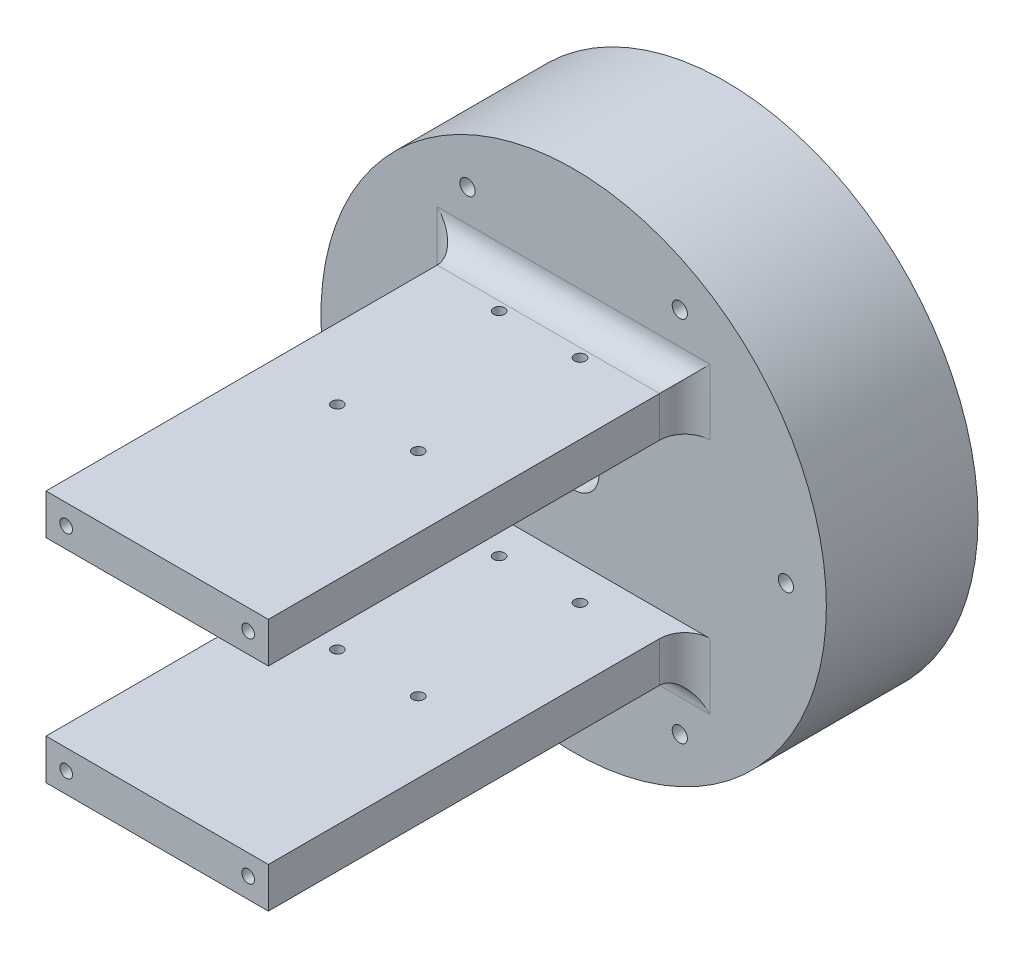
from build123d import *

# Parameters (mm, degrees)
CROQUIS1_R              = 50
SALIENTE_EXTRUIR1_DEPTH = 30
CROQUIS2_R              = 40.25
CORTAR_EXTRUIR1_DEPTH   = 10.5
CROQUIS3_R              = 21.5
SALIENTE_EXTRUIR2_DEPTH = 12.9
CORTAR_EXTRUIR2_DEPTH   = 12.9
CROQUIS7_W              = 44
CROQUIS7_H              = 8
SALIENTE_EXTRUIR3_DEPTH = 82.4
REDONDEO1_R             = 5
CORTAR_EXTRUIR3_REACH   = 146.079
CROQUIS8_R              = 1.1
CROQUIS9_R              = 1.5
CORTAR_EXTRUIR4_DEPTH   = 7
CROQUIS11_R             = 1.25
CORTAR_EXTRUIR5_DEPTH   = 15
SALIENTE_EXTRUIR4_START = 10.5
CROQUIS12_R             = 40.25
CROQUIS12_R_2           = 37.68
SALIENTE_EXTRUIR4_DEPTH = 10.5
CORTAR_EXTRUIR6_REACH   = 126.031
CROQUIS13_R             = 5
CROQUIS14_W             = 27
CROQUIS14_H             = 10
CORTAR_EXTRUIR7_DEPTH   = 5
CORTAR_EXTRUIR8_START   = -2.5
CROQUIS15_R             = 35
CROQUIS15_R_2           = 21.5
CORTAR_EXTRUIR8_DEPTH   = 2.5


with BuildPart() as part:
    # Croquis1 → Saliente-Extruir1 (new body)
    with BuildSketch(Plane.XY):
        Circle(CROQUIS1_R)
    extrude(amount=SALIENTE_EXTRUIR1_DEPTH)

    # Croquis2 → Cortar-Extruir1 (cut)
    with BuildSketch(Plane(origin=(0, 0, 0), x_dir=(-1, 0, 0), z_dir=(0, 0, -1))):
        Circle(CROQUIS2_R)
    extrude(amount=-CORTAR_EXTRUIR1_DEPTH, mode=Mode.SUBTRACT)

    # Croquis3 → Saliente-Extruir2 (add)
    with BuildSketch(Plane(origin=(0, 0, 10.5), x_dir=(-1, 0, 0), z_dir=(0, 0, -1))):
        with Locations(Location((0, 0, 0), (0, 0, 180))):
            Circle(CROQUIS3_R)
    extrude(amount=SALIENTE_EXTRUIR2_DEPTH)

    # Croquis4 → Cortar-Extruir2 (cut)
    with BuildSketch(Plane(origin=(0, 0, -2.4), x_dir=(-1, 0, 0), z_dir=(0, 0, -1))):
        with BuildLine():
            ThreePointArc((-0.668583659, -6.566048727), (0.596468383, -7.752086846), (1.665189454, -6.386481354))
            ThreePointArc((1.665189454, -6.386481354), (2.986052332, -5.885872193), (4.170137542, -5.11565762))
            ThreePointArc((4.170137542, -5.11565762), (5.903320016, -5.059786339), (5.693391028, -3.338457518))
            ThreePointArc((5.693391028, -3.338457518), (6.273397994, -2.050482288), (6.566048727, -0.668583659))
            ThreePointArc((6.566048727, -0.668583659), (7.752086846, 0.596468383), (6.386481354, 1.665189454))
            ThreePointArc((6.386481354, 1.665189454), (5.885872193, 2.986052332), (5.11565762, 4.170137542))
            ThreePointArc((5.11565762, 4.170137542), (5.059786339, 5.903320016), (3.338457518, 5.693391028))
            ThreePointArc((3.338457518, 5.693391028), (2.050482288, 6.273397994), (0.668583659, 6.566048727))
            ThreePointArc((0.668583659, 6.566048727), (-0.596468383, 7.752086846), (-1.665189454, 6.386481354))
            ThreePointArc((-1.665189454, 6.386481354), (-2.986052332, 5.885872193), (-4.170137542, 5.11565762))
            ThreePointArc((-4.170137542, 5.11565762), (-5.903320016, 5.059786339), (-5.693391028, 3.338457518))
            ThreePointArc((-5.693391028, 3.338457518), (-6.273397994, 2.050482288), (-6.566048727, 0.668583659))
            ThreePointArc((-6.566048727, 0.668583659), (-7.752086846, -0.596468383), (-6.386481354, -1.665189454))
            ThreePointArc((-6.386481354, -1.665189454), (-5.885872193, -2.986052332), (-5.11565762, -4.170137542))
            ThreePointArc((-5.11565762, -4.170137542), (-5.059786339, -5.903320016), (-3.338457518, -5.693391028))
            ThreePointArc((-3.338457518, -5.693391028), (-2.050482288, -6.273397994), (-0.668583659, -6.566048727))
        make_face()
    extrude(amount=-CORTAR_EXTRUIR2_DEPTH, mode=Mode.SUBTRACT)

    # Croquis7 → Saliente-Extruir3 (add)
    with BuildSketch(Plane.XY.offset(30)):
        with Locations((0, -21)):
            Rectangle(CROQUIS7_W, CROQUIS7_H)
        with Locations((0, 21)):
            Rectangle(CROQUIS7_W, CROQUIS7_H)
    extrude(amount=SALIENTE_EXTRUIR3_DEPTH)

    # Redondeo1
    redondeo1_edges = [part.edges().sort_by_distance(p)[0] for p in [
        (22, -21, 30),
        (-22, -21, 30),
        (0, -25, 30),
        (22, 21, 30),
        (0, 25, 30),
        (-22, 21, 30),
    ]]
    fillet(redondeo1_edges, radius=REDONDEO1_R)

    # Cortar-Extruir3: up to this face of the body (flat: up to its plane)
    cortar_extruir3_end = Plane(part.part.faces().sort_by_distance((0, 25, 73.7))[0])
    # Croquis8 → Cortar-Extruir3 (cut, up to the picked face)
    with BuildSketch(Plane.XZ.offset(25), mode=Mode.PRIVATE) as cortar_extruir3_sk1:
        with Locations(Location((-8, 36.75, 0), (0, 0, 270))):
            Circle(CROQUIS8_R)
    cortar_extruir3_tool1 = split(extrude(cortar_extruir3_sk1.sketch, amount=-CORTAR_EXTRUIR3_REACH, mode=Mode.PRIVATE), bisect_by=cortar_extruir3_end, keep=Keep.BOTH, mode=Mode.PRIVATE)
    # Croquis8 → Cortar-Extruir3 (cut, up to the picked face)
    with BuildSketch(Plane.XZ.offset(25), mode=Mode.PRIVATE) as cortar_extruir3_sk2:
        with Locations(Location((8, 36.75, 0), (0, 0, 270))):
            Circle(CROQUIS8_R)
    cortar_extruir3_tool2 = split(extrude(cortar_extruir3_sk2.sketch, amount=-CORTAR_EXTRUIR3_REACH, mode=Mode.PRIVATE), bisect_by=cortar_extruir3_end, keep=Keep.BOTH, mode=Mode.PRIVATE)
    # Croquis8 → Cortar-Extruir3 (cut, up to the picked face)
    with BuildSketch(Plane.XZ.offset(25), mode=Mode.PRIVATE) as cortar_extruir3_sk3:
        with Locations(Location((-8, 68.75, 0), (0, 0, 270))):
            Circle(CROQUIS8_R)
    cortar_extruir3_tool3 = split(extrude(cortar_extruir3_sk3.sketch, amount=-CORTAR_EXTRUIR3_REACH, mode=Mode.PRIVATE), bisect_by=cortar_extruir3_end, keep=Keep.BOTH, mode=Mode.PRIVATE)
    # Croquis8 → Cortar-Extruir3 (cut, up to the picked face)
    with BuildSketch(Plane.XZ.offset(25), mode=Mode.PRIVATE) as cortar_extruir3_sk4:
        with Locations(Location((8, 68.75, 0), (0, 0, 270))):
            Circle(CROQUIS8_R)
    cortar_extruir3_tool4 = split(extrude(cortar_extruir3_sk4.sketch, amount=-CORTAR_EXTRUIR3_REACH, mode=Mode.PRIVATE), bisect_by=cortar_extruir3_end, keep=Keep.BOTH, mode=Mode.PRIVATE)
    add(cortar_extruir3_tool1.solids().sort_by(Axis((-8, -25, 36.75), (0, 1, 0)))[0], mode=Mode.SUBTRACT)
    add(cortar_extruir3_tool2.solids().sort_by(Axis((8, -25, 36.75), (0, 1, 0)))[0], mode=Mode.SUBTRACT)
    add(cortar_extruir3_tool3.solids().sort_by(Axis((-8, -25, 68.75), (0, 1, 0)))[0], mode=Mode.SUBTRACT)
    add(cortar_extruir3_tool4.solids().sort_by(Axis((8, -25, 68.75), (0, 1, 0)))[0], mode=Mode.SUBTRACT)

    # Croquis9 → Cortar-Extruir4 (cut)
    with BuildSketch(Plane.XY.offset(30)):
        with Locations((-42, 0)):
            Circle(CROQUIS9_R)
        with Locations((-21, 36.373066959)):
            Circle(CROQUIS9_R)
        with Locations((21, 36.373066959)):
            Circle(CROQUIS9_R)
        with Locations((42, 0)):
            Circle(CROQUIS9_R)
        with Locations((21, -36.373066959)):
            Circle(CROQUIS9_R)
        with Locations((-21, -36.373066959)):
            Circle(CROQUIS9_R)
    extrude(amount=-CORTAR_EXTRUIR4_DEPTH, mode=Mode.SUBTRACT)

    # Croquis11 → Cortar-Extruir5 (cut)
    with BuildSketch(Plane.XY.offset(112.4)):
        with Locations((-18, -21)):
            Circle(CROQUIS11_R)
        with Locations((18, -21)):
            Circle(CROQUIS11_R)
        with Locations((-18, 21)):
            Circle(CROQUIS11_R)
        with Locations((18, 21)):
            Circle(CROQUIS11_R)
    extrude(amount=-CORTAR_EXTRUIR5_DEPTH, mode=Mode.SUBTRACT)

    # Croquis12 → Saliente-Extruir4 (add)
    with BuildSketch(Plane(origin=(0, 0, 10.5), x_dir=(-1, 0, 0), z_dir=(0, 0, -1)).offset(SALIENTE_EXTRUIR4_START)):
        Circle(CROQUIS12_R)
        with Locations(Location((0, 0, 0), (0, 0, 180))):
            Circle(CROQUIS12_R_2, mode=Mode.SUBTRACT)
    extrude(amount=-SALIENTE_EXTRUIR4_DEPTH)

    # Croquis13 → Cortar-Extruir6 (cut, up to next)
    with BuildSketch(Plane(origin=(0, 0, 10.5), x_dir=(-1, 0, 0), z_dir=(0, 0, -1)), mode=Mode.PRIVATE) as cortar_extruir6_sk1:
        Circle(CROQUIS13_R)
    cortar_extruir6_tool1 = extrude(cortar_extruir6_sk1.sketch, amount=-CORTAR_EXTRUIR6_REACH, mode=Mode.PRIVATE) & part.part
    add(cortar_extruir6_tool1.solids().sort_by_distance((0, 0, 10.5))[0], mode=Mode.SUBTRACT)

    # Croquis14 → Cortar-Extruir7 (cut)
    with BuildSketch(Plane.XY.offset(30)):
        with Locations((-13.5, 0)):
            Rectangle(CROQUIS14_W, CROQUIS14_H)
    extrude(amount=-CORTAR_EXTRUIR7_DEPTH, mode=Mode.SUBTRACT)

    # Croquis15 → Cortar-Extruir8 (cut)
    with BuildSketch(Plane(origin=(0, 0, 10.5), x_dir=(-1, 0, 0), z_dir=(0, 0, -1)).offset(CORTAR_EXTRUIR8_START)):
        Circle(CROQUIS15_R)
        with Locations(Location((0, 0, 0), (0, 0, 180))):
            Circle(CROQUIS15_R_2, mode=Mode.SUBTRACT)
    extrude(amount=CORTAR_EXTRUIR8_DEPTH, mode=Mode.SUBTRACT)


solid = part.part
